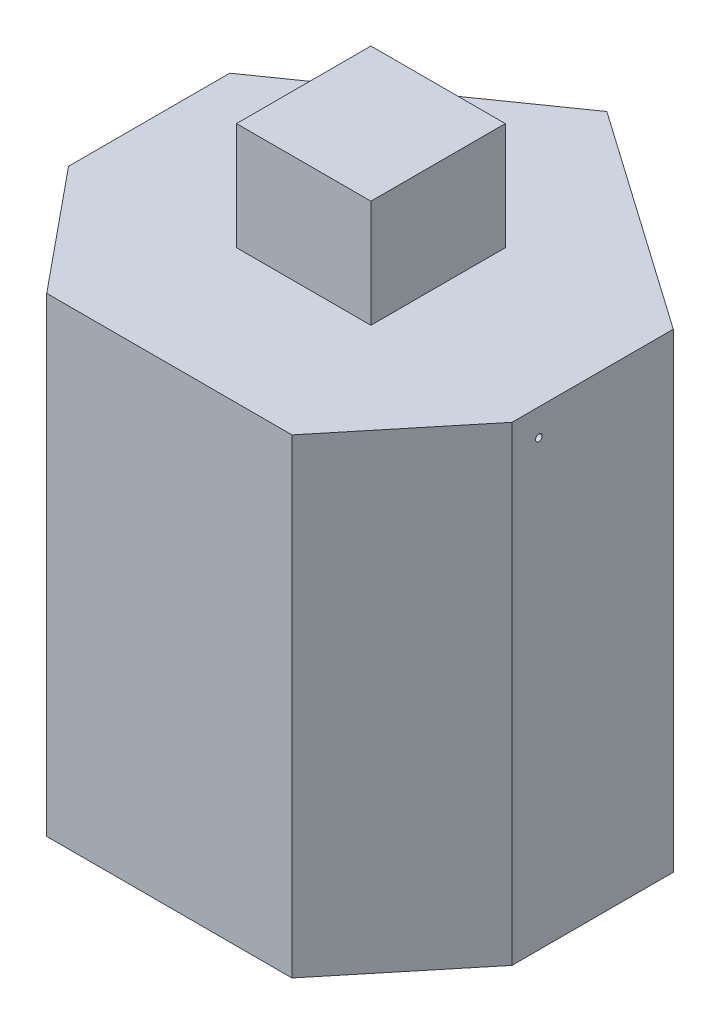
from build123d import *

# Parameters (mm, degrees)
BOSS_EXTRU_1_DEPTH      = 350
ESQUISSE2_W             = 100
ESQUISSE2_H             = 100
BOSS_EXTRU_2_DEPTH      = 430
ENL_V_MAT_EXTRU_1_DEPTH = 570.758720863
ESQUISSE4_R             = 2.5
ENL_V_MAT_EXTRU_2_DEPTH = 570.758720863


with BuildPart() as part:
    # Esquisse1 → Boss.-Extru.1 (new body)
    with BuildSketch(Plane(origin=(0, 0, 0), x_dir=(1, 0, 0), z_dir=(0, 1, 0))):
        Polygon((-165, 60), (0, 175.570498661), (165, 60), (165, -60), (91.241437954, -150), (-91.241437954, -150), (-165, -60), align=None)
    extrude(amount=BOSS_EXTRU_1_DEPTH)

    # Esquisse2 → Boss.-Extru.2 (add)
    with BuildSketch(Plane(origin=(0, 0, 0), x_dir=(1, 0, 0), z_dir=(0, 1, 0))):
        Rectangle(ESQUISSE2_W, ESQUISSE2_H)
    extrude(amount=BOSS_EXTRU_2_DEPTH)

    # Esquisse3 → Enlèv. mat.-Extru.1 (cut, through all)
    with BuildSketch(Plane(origin=(165, 0, 0), x_dir=(0, 0, -1), z_dir=(1, 0, 0))):
        Polygon((175.570498661, 0), (120, 0), (120, 280), (65, 280), (65, 340), (175.570498661, 340), align=None)
    extrude(amount=-ENL_V_MAT_EXTRU_1_DEPTH, mode=Mode.SUBTRACT)

    # Esquisse4 → Enlèv. mat.-Extru.2 (cut, through all)
    with BuildSketch(Plane(origin=(165, 0, 0), x_dir=(0, 0, -1), z_dir=(1, 0, 0))):
        with Locations((-40, 330)):
            Circle(ESQUISSE4_R)
    extrude(amount=-ENL_V_MAT_EXTRU_2_DEPTH, mode=Mode.SUBTRACT)


solid = part.part
